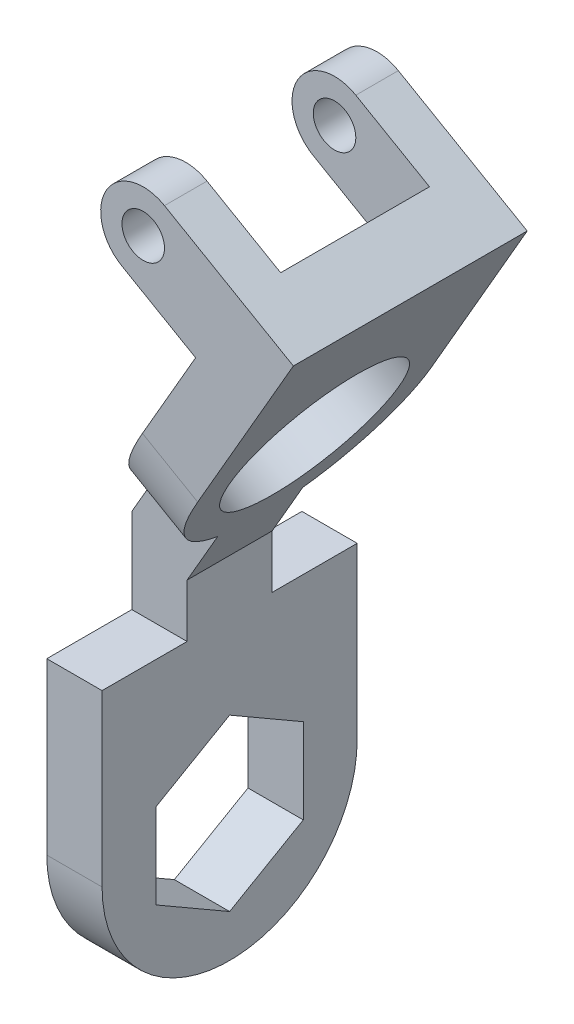
from build123d import *

# Parameters (mm, degrees)
BOSS_EXTRUDE1_DEPTH      = 16.51
SKETCH2_R                = 25.4
BOSS_EXTRUDE2_DEPTH      = 19.05
BOSS_EXTRUDE3_DEPTH      = 34.925
BOSS_EXTRUDE3_DEPTH_BACK = 34.925
SKETCH3_R                = 6.35
SKETCH3_2_R              = 6.35
CUT_EXTRUDE1_DEPTH       = 22.225


with BuildPart() as part:
    # Sketch1 → Boss-Extrude1 (new body)
    with BuildSketch(Plane(origin=(0, 0, 0), x_dir=(0, 0, -1), z_dir=(1, 0, 0))):
        with BuildLine():
            Line((-38.1, 0), (-38.1, 50.8))
            Line((-38.1, 50.8), (-12.7, 50.8))
            Line((-12.7, 50.8), (-12.7, 76.2))
            Line((-12.7, 76.2), (12.7, 76.2))
            Line((12.7, 76.2), (12.7, 50.8))
            Line((12.7, 50.8), (38.1, 50.8))
            Line((38.1, 50.8), (38.1, 0))
            ThreePointArc((38.1, 0), (0, -38.1), (-38.1, 0))
        make_face()
        Polygon((0, 25.4), (-21.997045256, 12.7), (-21.997045256, -12.7), (0, -25.4), (21.997045256, -12.7), (21.997045256, 12.7), align=None, mode=Mode.SUBTRACT)
    extrude(amount=BOSS_EXTRUDE1_DEPTH)

    # Sketch2 → Boss-Extrude2 (add)
    with BuildSketch(Plane(origin=(-32.995567884, 19.05, 0), x_dir=(0, 0, 1), z_dir=(0.8660254037844416, -0.49999999999999495, 0))):
        with BuildLine():
            Line((-12.7, -65.991135768), (12.7, -65.991135768))
            Line((12.7, -65.991135768), (12.7, -84.257067086))
            ThreePointArc((12.7, -84.257067086), (28.838369623, -97.090778855), (34.925, -116.791135768))
            Line((34.925, -116.791135768), (34.925, -173.941135768))
            Line((34.925, -173.941135768), (-34.925, -173.941135768))
            Line((-34.925, -173.941135768), (-34.925, -116.791135768))
            ThreePointArc((-34.925, -116.791135768), (-28.838369623, -97.090778855), (-12.7, -84.257067086))
            Line((-12.7, -84.257067086), (-12.7, -65.991135768))
        make_face()
        with Locations((0, -116.791135768)):
            Circle(SKETCH2_R, mode=Mode.SUBTRACT)
    extrude(amount=BOSS_EXTRUDE2_DEPTH)

    # Sketch3 → Boss-Extrude3 (add, two sides: drawn at the far end of the back side and taken through both)
    with BuildSketch(Plane.XY.offset(-BOSS_EXTRUDE3_DEPTH_BACK)):
        with BuildLine():
            Line((53.975, 169.687442339), (31.977954744, 182.387442339))
            ThreePointArc((31.977954744, 182.387442339), (14.629432116, 177.73891971), (19.277954744, 160.390397082))
            Line((19.277954744, 160.390397082), (41.275, 147.690397082))
            Line((41.275, 147.690397082), (53.975, 169.687442339))
        make_face()
        with Locations((25.627954744, 171.38891971)):
            Circle(SKETCH3_R, mode=Mode.SUBTRACT)
    extrude(amount=BOSS_EXTRUDE3_DEPTH + BOSS_EXTRUDE3_DEPTH_BACK)

    # Sketch3<2> → Cut-Extrude1 (cut, symmetric)
    with BuildSketch(Plane.XY):
        with BuildLine():
            Line((53.975, 169.687442339), (31.977954744, 182.387442339))
            ThreePointArc((31.977954744, 182.387442339), (14.629432116, 177.73891971), (19.277954744, 160.390397082))
            Line((19.277954744, 160.390397082), (41.275, 147.690397082))
            Line((41.275, 147.690397082), (53.975, 169.687442339))
        make_face()
        with Locations((25.627954744, 171.38891971)):
            Circle(SKETCH3_2_R, mode=Mode.SUBTRACT)
    extrude(amount=CUT_EXTRUDE1_DEPTH, both=True, mode=Mode.SUBTRACT)


solid = part.part
